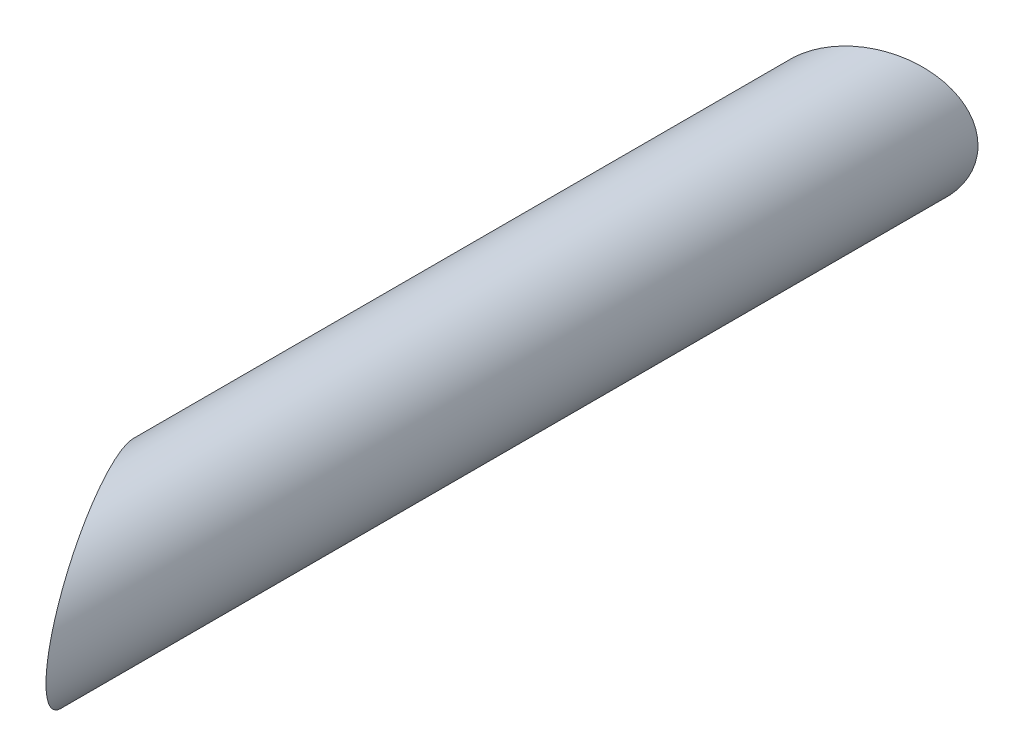
from build123d import *

# Parameters (mm, degrees)
SKETCH2_R           = 7.5
BOSS_EXTRUDE1_DEPTH = 100
CUT_EXTRUDE1_DEPTH  = 50
SKETCH5_R           = 2.5
CUT_EXTRUDE2_DEPTH  = 10
SKETCH6_R           = 2.5
CUT_EXTRUDE3_DEPTH  = 7


with BuildPart() as part:
    # Sketch2 → Boss-Extrude1 (new body)
    with BuildSketch(Plane.XY):
        Circle(SKETCH2_R)
    extrude(amount=BOSS_EXTRUDE1_DEPTH)

    # Sketch3 → Cut-Extrude1 (cut, symmetric)
    with BuildSketch(Plane(origin=(0, 0, 0), x_dir=(1, 0, 0), z_dir=(0, 1, 0))):
        Polygon((7.5, 0), (-16.600154846, -13.914230888), (-16.600154846, 6.795957579), (7.5, 6.795957579), align=None)
        Polygon((7.5, -100), (-10.5, -68.823085464), (-10.5, -108.823085464), (7.5, -108.823085464), align=None)
    extrude(amount=CUT_EXTRUDE1_DEPTH, both=True, mode=Mode.SUBTRACT)

    # Sketch5 → Cut-Extrude2 (cut)
    with BuildSketch(Plane(origin=(1.875, 0, 3.247595264), x_dir=(-0.8660254037844379, 0, 0.5000000000000013), z_dir=(-0.5000000000000013, 0, -0.8660254037844379))):
        with Locations((4.825317547, 0)):
            Circle(SKETCH5_R)
    extrude(amount=-CUT_EXTRUDE2_DEPTH, mode=Mode.SUBTRACT)

    # Sketch6 → Cut-Extrude3 (cut)
    with BuildSketch(Plane(origin=(-37.676270189, 0, 21.752404736), x_dir=(0.5000000000000042, 0, 0.8660254037844363), z_dir=(-0.8660254037844363, 0, 0.5000000000000042))):
        with Locations((68.352540378, 0)):
            Circle(SKETCH6_R)
    extrude(amount=-CUT_EXTRUDE3_DEPTH, mode=Mode.SUBTRACT)


solid = part.part
